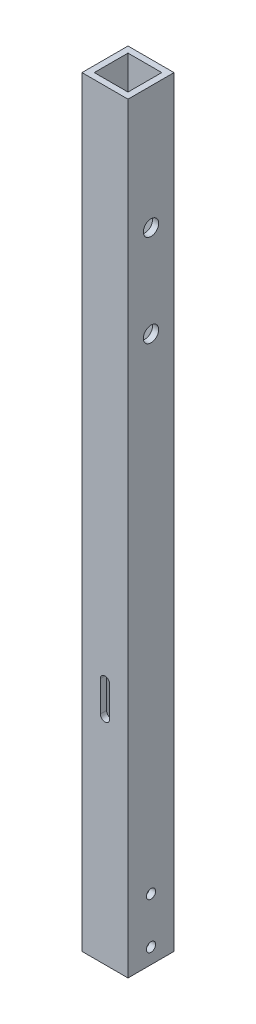
from build123d import *

# Parameters (mm, degrees)
SKETCH_1_W          = 15
SKETCH_1_H          = 15
EXTRUDE_1_DEPTH     = 248
SKETCH_3_R          = 1.5
CUT_EXTRUDE_2_DEPTH = 15
CUT_EXTRUDE_3_DEPTH = 15
SKETCH_5_W          = 11
SKETCH_5_H          = 11
CUT_EXTRUDE_4_DEPTH = 248
SKETCH_6_R          = 2.5
CUT_EXTRUDE_5_DEPTH = 15


with BuildPart() as part:
    # 草图1 → 凸台-拉伸1 (new body)
    with BuildSketch(Plane(origin=(0, 0, 0), x_dir=(1, 0, 0), z_dir=(0, 1, 0))):
        Rectangle(SKETCH_1_W, SKETCH_1_H)
    extrude(amount=EXTRUDE_1_DEPTH)

    # 草图3 → 切除-拉伸2 (cut)
    with BuildSketch(Plane(origin=(7.5, 0, 0), x_dir=(0, 0, -1), z_dir=(1, 0, 0))):
        with Locations((0, 5)):
            Circle(SKETCH_3_R)
        with Locations((0, 20)):
            Circle(SKETCH_3_R)
    extrude(amount=-CUT_EXTRUDE_2_DEPTH, mode=Mode.SUBTRACT)

    # 草图4 → 切除-拉伸3 (cut)
    with BuildSketch(Plane.XY.offset(7.5)):
        with BuildLine():
            Line((-1.5, 70), (-1.5, 80))
            ThreePointArc((-1.5, 80), (0, 81.5), (1.5, 80))
            Line((1.5, 80), (1.5, 70))
            ThreePointArc((1.5, 70), (0, 68.5), (-1.5, 70))
        make_face()
    extrude(amount=-CUT_EXTRUDE_3_DEPTH, mode=Mode.SUBTRACT)

    # 草图5 → 切除-拉伸4 (cut)
    with BuildSketch(Plane(origin=(0, 248, 0), x_dir=(1, 0, 0), z_dir=(0, 1, 0))):
        Rectangle(SKETCH_5_W, SKETCH_5_H)
    extrude(amount=-CUT_EXTRUDE_4_DEPTH, mode=Mode.SUBTRACT)

    # 草图6 → 切除-拉伸5 (cut)
    with BuildSketch(Plane.ZY.offset(7.5)):
        with Locations((0, 208)):
            Circle(SKETCH_6_R)
        with Locations((0, 178)):
            Circle(SKETCH_6_R)
    extrude(amount=-CUT_EXTRUDE_5_DEPTH, mode=Mode.SUBTRACT)


solid = part.part
